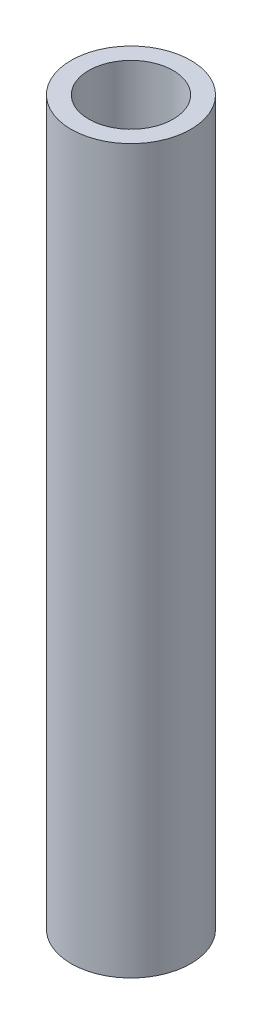
from build123d import *

# Parameters (mm, degrees)
CROQUIS1_R              = 8.5
CROQUIS1_R_2            = 6
SALIENTE_EXTRUIR1_DEPTH = 102.7


with BuildPart() as part:
    # Croquis1 → Saliente-Extruir1 (new body)
    with BuildSketch(Plane(origin=(0, 0, 0), x_dir=(1, 0, 0), z_dir=(0, 1, 0))):
        with Locations(Location((0, 0, 0), (0, 0, 270))):
            Circle(CROQUIS1_R)
        with Locations(Location((0, 0, 0), (0, 0, 270))):
            Circle(CROQUIS1_R_2, mode=Mode.SUBTRACT)
    extrude(amount=SALIENTE_EXTRUIR1_DEPTH)


solid = part.part
